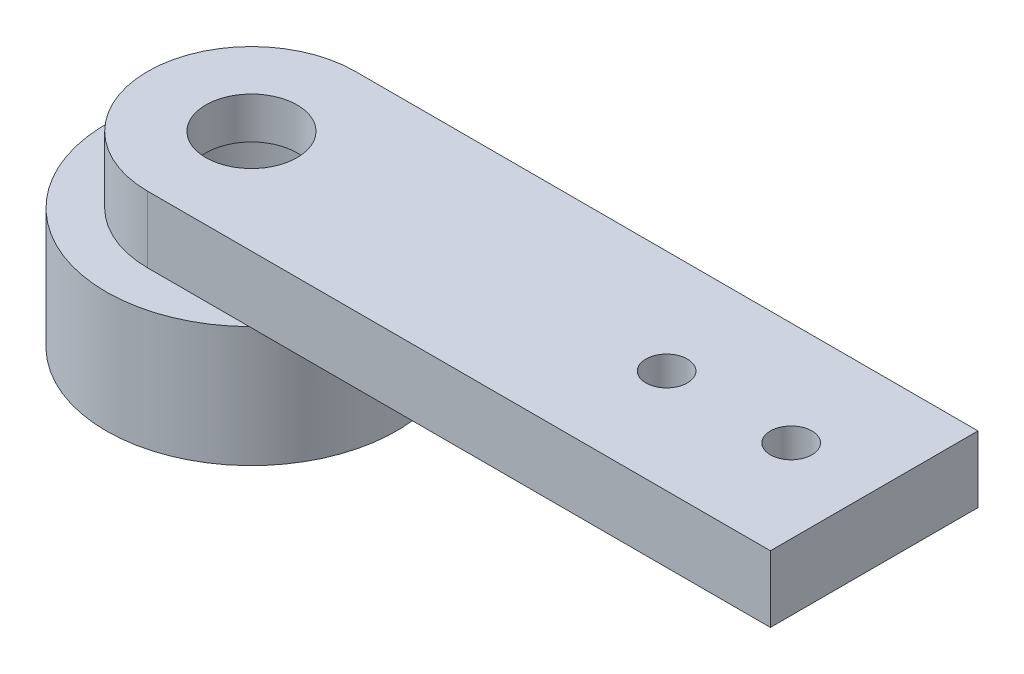
from build123d import *

# Parameters (mm, degrees)
BOSS_EXTRUDE1_DEPTH = 1.6
SKETCH2_R           = 3.5
BOSS_EXTRUDE2_DEPTH = 2.9
SKETCH3_R           = 2.425
CUT_EXTRUDE2_DEPTH  = 3.5
SKETCH4_R           = 1.1
CUT_EXTRUDE4_DEPTH  = 1
SKETCH5_R           = 0.5
CUT_EXTRUDE6_DEPTH  = 1.6
SKETCH6_R           = 0.5
CUT_EXTRUDE8_DEPTH  = 1.6


with BuildPart() as part:
    # Sketch1 → Boss-Extrude1 (new body)
    with BuildSketch(Plane(origin=(0, 19.3, 0), x_dir=(1, 0, 0), z_dir=(0, 1, 0))):
        with BuildLine():
            Line((5.5, -2.5), (20.5, -2.5))
            Line((20.5, -2.5), (20.5, 2.5))
            Line((20.5, 2.5), (5.5, 2.5))
            ThreePointArc((5.5, 2.5), (3, 0), (5.5, -2.5))
        make_face()
    extrude(amount=BOSS_EXTRUDE1_DEPTH)

    # Sketch2 → Boss-Extrude2 (add)
    with BuildSketch(Plane(origin=(0, 16.4, 0), x_dir=(1, 0, 0), z_dir=(0, 1, 0))):
        with Locations(Location((5.5, 0, 0), (0, 0, 45.584691403))):
            Circle(SKETCH2_R)
    extrude(amount=BOSS_EXTRUDE2_DEPTH)

    # Sketch3 → Cut-Extrude2 (cut)
    with BuildSketch(Plane(origin=(0, 16.4, 0), x_dir=(1, 0, 0), z_dir=(0, 1, 0))):
        with Locations(Location((5.5, 0, 0), (0, 0, 270))):
            Circle(SKETCH3_R)
    extrude(amount=CUT_EXTRUDE2_DEPTH, mode=Mode.SUBTRACT)

    # Sketch4 → Cut-Extrude4 (cut)
    with BuildSketch(Plane(origin=(0, 19.9, 0), x_dir=(1, 0, 0), z_dir=(0, 1, 0))):
        with Locations(Location((5.5, 0, 0), (0, 0, 270))):
            Circle(SKETCH4_R)
    extrude(amount=CUT_EXTRUDE4_DEPTH, mode=Mode.SUBTRACT)

    # Sketch5 → Cut-Extrude6 (cut)
    with BuildSketch(Plane(origin=(0, 19.3, 0), x_dir=(1, 0, 0), z_dir=(0, 1, 0))):
        with Locations(Location((15.5, 0, 0), (0, 0, 270))):
            Circle(SKETCH5_R)
    extrude(amount=CUT_EXTRUDE6_DEPTH, mode=Mode.SUBTRACT)

    # Sketch6 → Cut-Extrude8 (cut)
    with BuildSketch(Plane(origin=(0, 19.3, 0), x_dir=(1, 0, 0), z_dir=(0, 1, 0))):
        with Locations(Location((18.5, 0, 0), (0, 0, 270))):
            Circle(SKETCH6_R)
    extrude(amount=CUT_EXTRUDE8_DEPTH, mode=Mode.SUBTRACT)


solid = part.part
